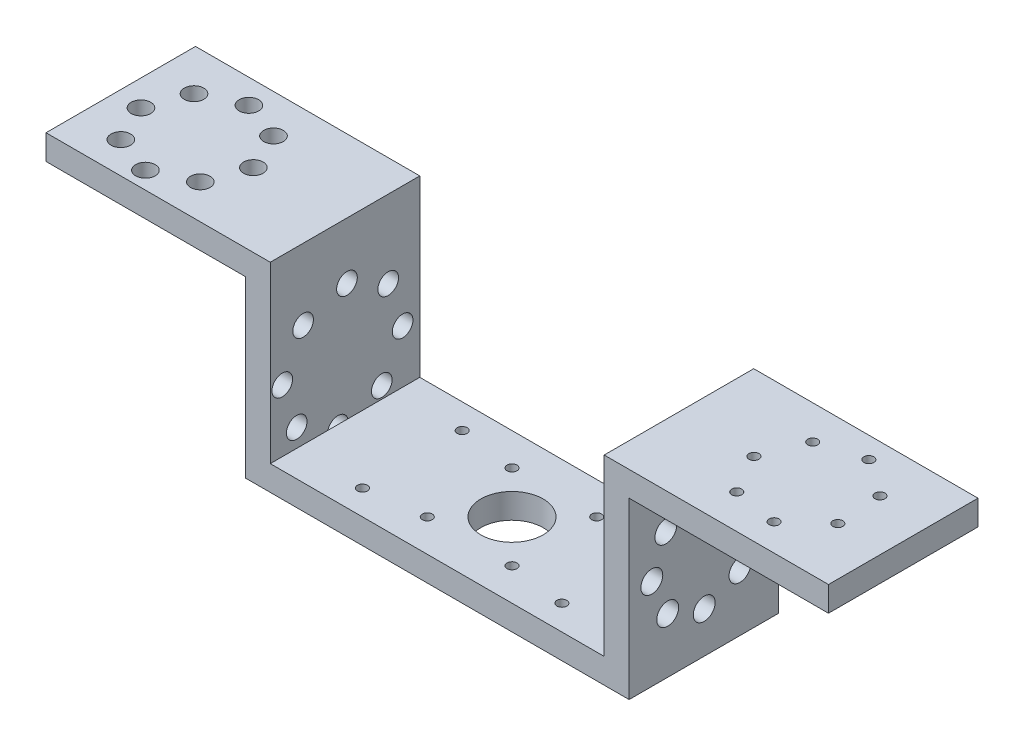
from build123d import *

# Parameters (mm, degrees)
SKETCH2_R           = 2.246119438
BOSS_EXTRUDE1_DEPTH = 5
SKETCH1_W           = 67
SKETCH1_H           = 30
SKETCH1_R           = 6.25
SKETCH1_R_2         = 1
BOSS_EXTRUDE3_DEPTH = 5
SKETCH8_W           = 30
SKETCH8_H           = 40
BOSS_EXTRUDE4_DEPTH = 5
SKETCH9_W           = 30
SKETCH9_H           = 40
BOSS_EXTRUDE5_DEPTH = 5
SKETCH11_W          = 30
SKETCH11_H          = 5
BOSS_EXTRUDE6_DEPTH = 40
SKETCH12_W          = 30
SKETCH12_H          = 5
BOSS_EXTRUDE7_DEPTH = 40
SKETCH13_R          = 2.195864451
CUT_EXTRUDE1_DEPTH  = 5
SKETCH14_R          = 1
CUT_EXTRUDE2_DEPTH  = 5
SKETCH15_R          = 2.070506859
CUT_EXTRUDE3_DEPTH  = 5
SKETCH16_R          = 1.962714384
CUT_EXTRUDE4_DEPTH  = 5


with BuildPart() as part:
    # Sketch2 → Boss-Extrude1 (new body)
    with BuildSketch(Plane(origin=(0, 0, 0), x_dir=(0, 0, -1), z_dir=(1, 0, 0))):
        with BuildLine():
            Line((30, 0), (0, 0))
            Line((0, 0), (0, 40))
            Line((0, 40), (7.960594487, 40))
            ThreePointArc((7.960594487, 40), (14.468438583, 30), (20.976282678, 40))
            Line((20.976282678, 40), (30, 40))
            Line((30, 40), (30, 0))
        make_face()
        with Locations((14.468438583, 24.238644745)):
            Circle(SKETCH2_R, mode=Mode.SUBTRACT)
        with Locations((6.578911504, 27.652835849)):
            Circle(SKETCH2_R, mode=Mode.SUBTRACT)
        with Locations((3.414371088, 35.645771628)):
            Circle(SKETCH2_R, mode=Mode.SUBTRACT)
        with Locations((25.875565465, 35.29271224)):
            Circle(SKETCH2_R, mode=Mode.SUBTRACT)
        with Locations((22.461374361, 27.403185161)):
            Circle(SKETCH2_R, mode=Mode.SUBTRACT)
    boss_extrude1 = extrude(amount=-BOSS_EXTRUDE1_DEPTH)

    # Sketch1 → Boss-Extrude3 (add)
    with BuildSketch(Plane(origin=(0, 0, 0), x_dir=(1, 0, 0), z_dir=(0, 1, 0))):
        with Locations((33.5, 15)):
            Rectangle(SKETCH1_W, SKETCH1_H)
        with Locations(Location((33.5, 15, 0), (0, 0, 270))):
            Circle(SKETCH1_R, mode=Mode.SUBTRACT)
        with Locations(Location((42, 23.5, 0), (0, 0, 270))):
            Circle(SKETCH1_R_2, mode=Mode.SUBTRACT)
        with Locations(Location((42, 6.5, 0), (0, 0, 270))):
            Circle(SKETCH1_R_2, mode=Mode.SUBTRACT)
        with Locations(Location((25, 6.5, 0), (0, 0, 270))):
            Circle(SKETCH1_R_2, mode=Mode.SUBTRACT)
        with Locations(Location((25, 23.5, 0), (0, 0, 270))):
            Circle(SKETCH1_R_2, mode=Mode.SUBTRACT)
        with Locations(Location((53.5, 5, 0), (0, 0, 270))):
            Circle(SKETCH1_R_2, mode=Mode.SUBTRACT)
        with Locations(Location((53.5, 25, 0), (0, 0, 270))):
            Circle(SKETCH1_R_2, mode=Mode.SUBTRACT)
        with Locations(Location((13.5, 25, 0), (0, 0, 270))):
            Circle(SKETCH1_R_2, mode=Mode.SUBTRACT)
        with Locations(Location((13.5, 5, 0), (0, 0, 270))):
            Circle(SKETCH1_R_2, mode=Mode.SUBTRACT)
    extrude(amount=BOSS_EXTRUDE3_DEPTH)

    # Mirror1: Boss-Extrude1 across plane
    add(boss_extrude1.mirror(Plane(origin=(33.5, 0, 0), x_dir=(0, 0, 1), z_dir=(1, 0, 0))))

    # Sketch8 → Boss-Extrude4 (add)
    with BuildSketch(Plane.ZY.offset(5)):
        with Locations((-15, 20)):
            Rectangle(SKETCH8_W, SKETCH8_H)
    extrude(amount=-BOSS_EXTRUDE4_DEPTH)

    # Sketch9 → Boss-Extrude5 (add)
    with BuildSketch(Plane(origin=(72, 0, 0), x_dir=(0, 0, -1), z_dir=(1, 0, 0))):
        with Locations((15, 20)):
            Rectangle(SKETCH9_W, SKETCH9_H)
    extrude(amount=-BOSS_EXTRUDE5_DEPTH)

    # Sketch11 → Boss-Extrude6 (add)
    with BuildSketch(Plane(origin=(72, 0, 0), x_dir=(0, 0, -1), z_dir=(1, 0, 0))):
        with Locations((15, 37.5)):
            Rectangle(SKETCH11_W, SKETCH11_H)
    extrude(amount=BOSS_EXTRUDE6_DEPTH)

    # Sketch12 → Boss-Extrude7 (add)
    with BuildSketch(Plane.ZY.offset(5)):
        with Locations((-15, 37.5)):
            Rectangle(SKETCH12_W, SKETCH12_H)
    extrude(amount=BOSS_EXTRUDE7_DEPTH)

    # Sketch13 → Cut-Extrude1 (cut)
    with BuildSketch(Plane(origin=(72, 0, 0), x_dir=(0, 0, -1), z_dir=(1, 0, 0))):
        with Locations((4.552108339, 18.246803651)):
            Circle(SKETCH13_R)
        with Locations((7.738751357, 11.072716755)):
            Circle(SKETCH13_R)
        with Locations((15.064893737, 8.253168149)):
            Circle(SKETCH13_R)
        with Locations((22.238980633, 11.439811167)):
            Circle(SKETCH13_R)
        with Locations((25.058529239, 18.765953547)):
            Circle(SKETCH13_R)
        with Locations((21.871886221, 25.940040443)):
            Circle(SKETCH13_R)
        with Locations((14.545743841, 28.759589048)):
            Circle(SKETCH13_R)
        with Locations((7.371656945, 25.572946031)):
            Circle(SKETCH13_R)
    extrude(amount=-CUT_EXTRUDE1_DEPTH, mode=Mode.SUBTRACT)

    # Sketch14 → Cut-Extrude2 (cut)
    with BuildSketch(Plane.XZ.offset(-35)):
        with Locations(Location((82.265636432, -14.777839144, 0), (0, 0, 270))):
            Circle(SKETCH14_R)
        with Locations(Location((85.666207992, -23.170222577, 0), (0, 0, 270))):
            Circle(SKETCH14_R)
        with Locations(Location((94.347859261, -25.744114158, 0), (0, 0, 270))):
            Circle(SKETCH14_R)
        with Locations(Location((101.77312976, -20.561321027, 0), (0, 0, 270))):
            Circle(SKETCH14_R)
        with Locations(Location((102.350639356, -11.524592123, 0), (0, 0, 270))):
            Circle(SKETCH14_R)
        with Locations(Location((95.645511544, -5.438768625, 0), (0, 0, 270))):
            Circle(SKETCH14_R)
        with Locations(Location((86.706844325, -6.886599756, 0), (0, 0, 270))):
            Circle(SKETCH14_R)
    extrude(amount=-CUT_EXTRUDE2_DEPTH, mode=Mode.SUBTRACT)

    # Sketch15 → Cut-Extrude3 (cut)
    with BuildSketch(Plane.ZY.offset(5)):
        with Locations((-15.389362422, 28.629801574)):
            Circle(SKETCH15_R)
        with Locations((-23.658210405, 24.452096347)):
            Circle(SKETCH15_R)
        with Locations((-26.55108519, 15.65105417)):
            Circle(SKETCH15_R)
        with Locations((-22.373379963, 7.382206187)):
            Circle(SKETCH15_R)
        with Locations((-13.572337785, 4.489331401)):
            Circle(SKETCH15_R)
        with Locations((-5.303489803, 8.667036629)):
            Circle(SKETCH15_R)
        with Locations((-2.410615017, 17.468078806)):
            Circle(SKETCH15_R)
        with Locations((-6.588320245, 25.736926789)):
            Circle(SKETCH15_R)
    extrude(amount=-CUT_EXTRUDE3_DEPTH, mode=Mode.SUBTRACT)

    # Sketch16 → Cut-Extrude4 (cut)
    with BuildSketch(Plane.XZ.offset(-35)):
        with Locations(Location((-39.786222938, -13.841664359, 0), (0, 0, 270))):
            Circle(SKETCH16_R)
        with Locations(Location((-36.298214509, -6.315787831, 0), (0, 0, 270))):
            Circle(SKETCH16_R)
        with Locations(Location((-28.510221767, -3.460583916, 0), (0, 0, 270))):
            Circle(SKETCH16_R)
        with Locations(Location((-20.984345239, -6.948592346, 0), (0, 0, 270))):
            Circle(SKETCH16_R)
        with Locations(Location((-18.129141325, -14.736585087, 0), (0, 0, 270))):
            Circle(SKETCH16_R)
        with Locations(Location((-21.617149754, -22.262461615, 0), (0, 0, 270))):
            Circle(SKETCH16_R)
        with Locations(Location((-29.405142495, -25.11766553, 0), (0, 0, 270))):
            Circle(SKETCH16_R)
        with Locations(Location((-36.931019024, -21.6296571, 0), (0, 0, 270))):
            Circle(SKETCH16_R)
    extrude(amount=-CUT_EXTRUDE4_DEPTH, mode=Mode.SUBTRACT)


solid = part.part
